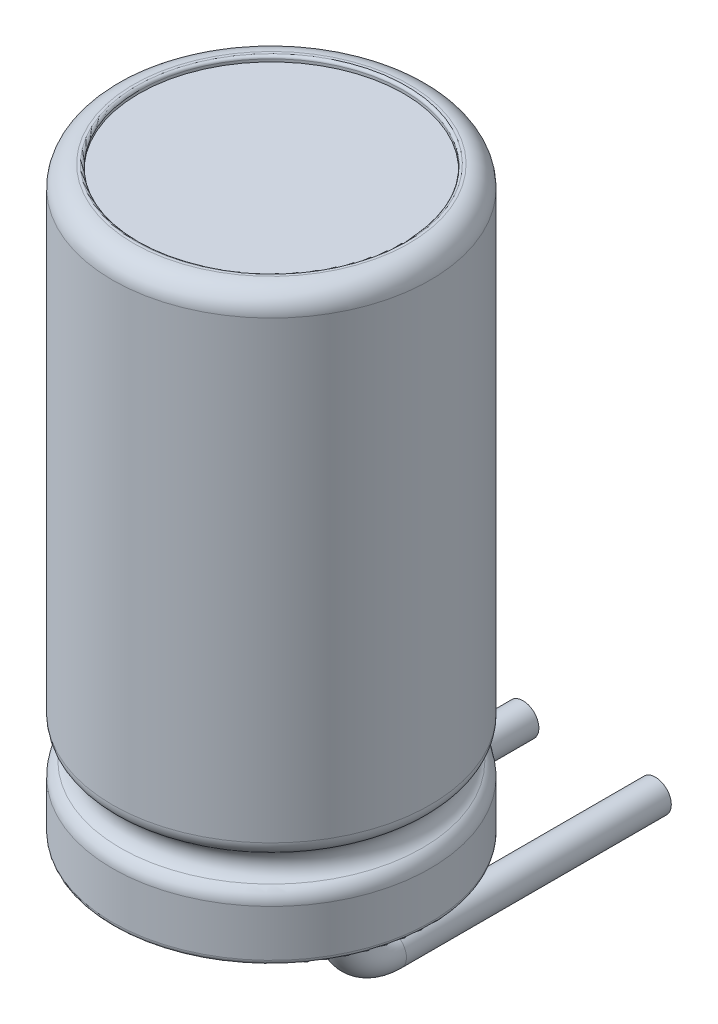
from build123d import *

# Parameters (mm, degrees)
SKETCH_2_R          = 3
EXTRUDE_1_DEPTH     = 11
SKETCH_3_R          = 2.5
CUT_EXTRUDE_1_DEPTH = 0.3
SKETCH_4_R          = 0.3
CUT_EXTRUDE_START   = -0.1
SKETCH_7_R          = 2.5
CUT_EXTRUDE_2_DEPTH = 0.1
FILLET_1_R          = 0.1
FILLET_2_R          = 0.3
FILLET_3_R          = 0.4
FILLET_4_R          = 0.05


with BuildPart() as part:
    # Эскиз2 → Бобышка-Вытянуть1 (new body)
    with BuildSketch(Plane(origin=(0, 0, 0), x_dir=(1, 0, 0), z_dir=(0, 1, 0))):
        with Locations(Location((0, 0, 0), (0, 0, 270))):
            Circle(SKETCH_2_R)
    extrude(amount=EXTRUDE_1_DEPTH)

    # Эскиз3 → Вырез-Вытянуть1 (cut)
    with BuildSketch(Plane.XZ):
        with Locations(Location((0, 0, 0), (0, 0, 270))):
            Circle(SKETCH_3_R)
    extrude(amount=-CUT_EXTRUDE_1_DEPTH, mode=Mode.SUBTRACT)

    # Эскиз7 → Вырез-Вытянуть2 (cut)
    with BuildSketch(Plane(origin=(0, 11, 0), x_dir=(1, 0, 0), z_dir=(0, 1, 0)).offset(CUT_EXTRUDE_START)):
        with Locations(Location((0, 0, 0), (0, 0, 90))):
            Circle(SKETCH_7_R)
    extrude(amount=CUT_EXTRUDE_2_DEPTH, mode=Mode.SUBTRACT)

    # Эскиз9 → Вырез-Повернуть1 (revolve, cut)
    with BuildSketch(Plane(origin=(0, 0, 0), x_dir=(0, 0, -1), z_dir=(1, 0, 0)), mode=Mode.PRIVATE) as cut_revolve_1_sk:
        with BuildLine():
            Line((-3, 1.8), (-3, 1.2))
            ThreePointArc((-3, 1.2), (-2.7, 1.5), (-3, 1.8))
        make_face()
    revolve(cut_revolve_1_sk.sketch.rotate(Axis((0, -2.369211138, 0), (0, 1, 0)), 180), axis=Axis((0, -2.369211138, 0), (0, 1, 0)), mode=Mode.SUBTRACT)

    # Скругление1
    fillet_1_edges = [part.edges().sort_by_distance(p)[0] for p in [
        (0, 0, -3),
        (0, 0, 2.5),
    ]]
    fillet(fillet_1_edges, radius=FILLET_1_R)

    # Скругление2
    fillet_2_edges = [part.edges().sort_by_distance(p)[0] for p in [
        (-3, 1.2, 0),
        (-3, 1.8, 0),
    ]]
    fillet(fillet_2_edges, radius=FILLET_2_R)

    # Скругление3
    fillet_3_edges = [part.edges().sort_by_distance(p)[0] for p in [
        (0, 11, -3),
    ]]
    fillet(fillet_3_edges, radius=FILLET_3_R)

    # Скругление4
    fillet_4_edges = [part.edges().sort_by_distance(p)[0] for p in [
        (0, 11, 2.5),
    ]]
    fillet(fillet_4_edges, radius=FILLET_4_R)


with BuildPart() as body_2:
    # По траектории1: sweep along a path in Эскиз6
    with BuildLine(Plane.ZY.offset(1.25)) as sweep_1_path:
        Line((0, 0.3), (0, -0.7))
        ThreePointArc((0, -0.7), (-0.292893219, -1.407106781), (-1, -1.7))
        Line((-1, -1.7), (-6, -1.7))
    # Эскиз4 → По траектории1 (sweep)
    with BuildSketch(Plane.XZ.offset(-0.3)):
        with Locations((-1.25, 0)):
            Circle(SKETCH_4_R)
    sweep(path=sweep_1_path.line)


with BuildPart() as body_3:
    # Зеркальное отражение1: mirrored copy
    add(body_2.part.mirror(Plane(origin=(0, 0, 0), x_dir=(0, 0, 1), z_dir=(1, 0, 0))))


solid = Compound([part.part, body_2.part, body_3.part])
